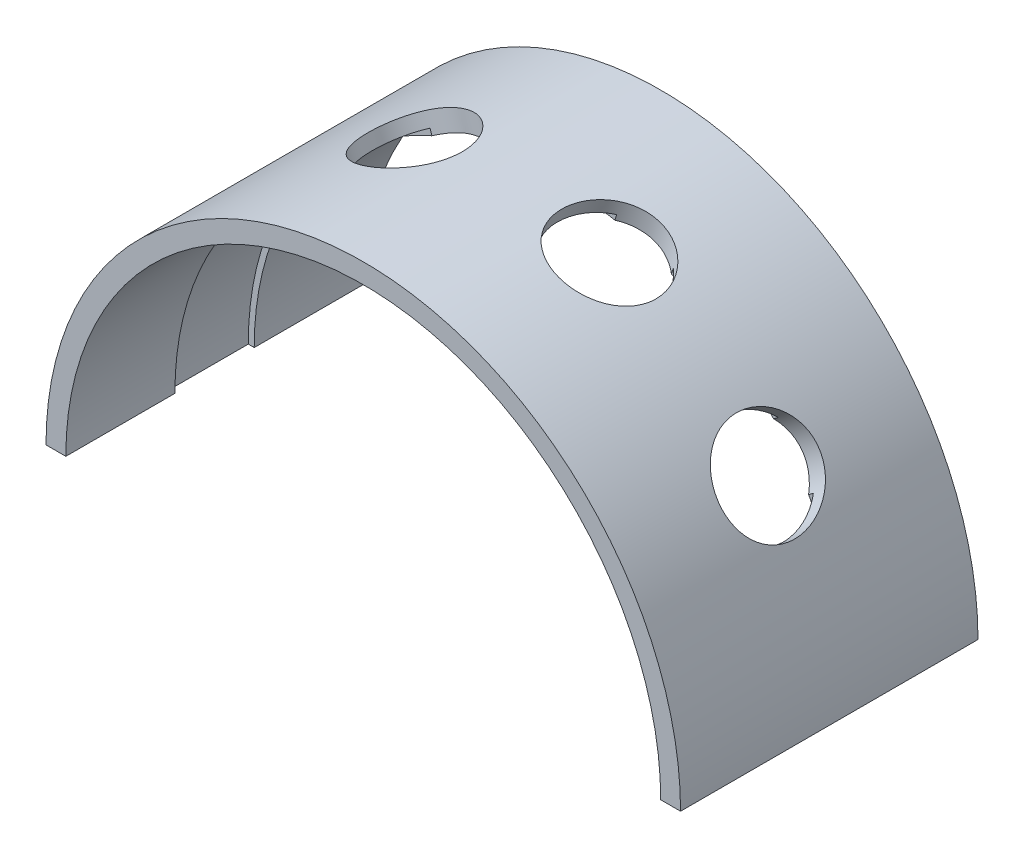
from build123d import *

# Parameters (mm, degrees)
CIRPATTERN1_COUNT = 4
CIRPATTERN1_ANGLE = 108


with BuildPart() as part:
    # Sweep1: sweep along a path in Sketch1
    with BuildLine(Plane.XY) as sweep1_path:
        ThreePointArc((-16, 0), (0, 16), (16, 0))
    # Sketch2 → Sweep1 (sweep)
    with BuildSketch(Plane(origin=(0, 0, 0), x_dir=(1, 0, 0), z_dir=(0, 1, 0))):
        Polygon((-15, -7.5), (-15, -2), (-15.3, -2), (-15.3, 2), (-15, 2), (-15, 7.5), (-16, 7.5), (-16, -7.5), align=None)
    sweep(path=sweep1_path.line)

    # Sketch3 → Cut-Revolve1 (revolve, cut)
    with BuildSketch(Plane.XY):
        Polygon((9.819754909, 7.134469556), (15.375889989, 11.171237983), (16.84535312, 9.148695497), (11.28921804, 5.11192707), align=None)
    cut_revolve1 = revolve(axis=Axis((9.819754909, 7.134469556, 0), (0.8090169943749488, 0.5877852522924712, 0)), mode=Mode.SUBTRACT)

    # CirPattern1: Cut-Revolve1 ×4 about axis
    cirpattern1_axis = Axis((0, 0, -11.55), (0, 0, 1))
    for i in range(1, CIRPATTERN1_COUNT):
        add(cut_revolve1.rotate(cirpattern1_axis, i * CIRPATTERN1_ANGLE / (CIRPATTERN1_COUNT - 1)), mode=Mode.SUBTRACT)


solid = part.part
